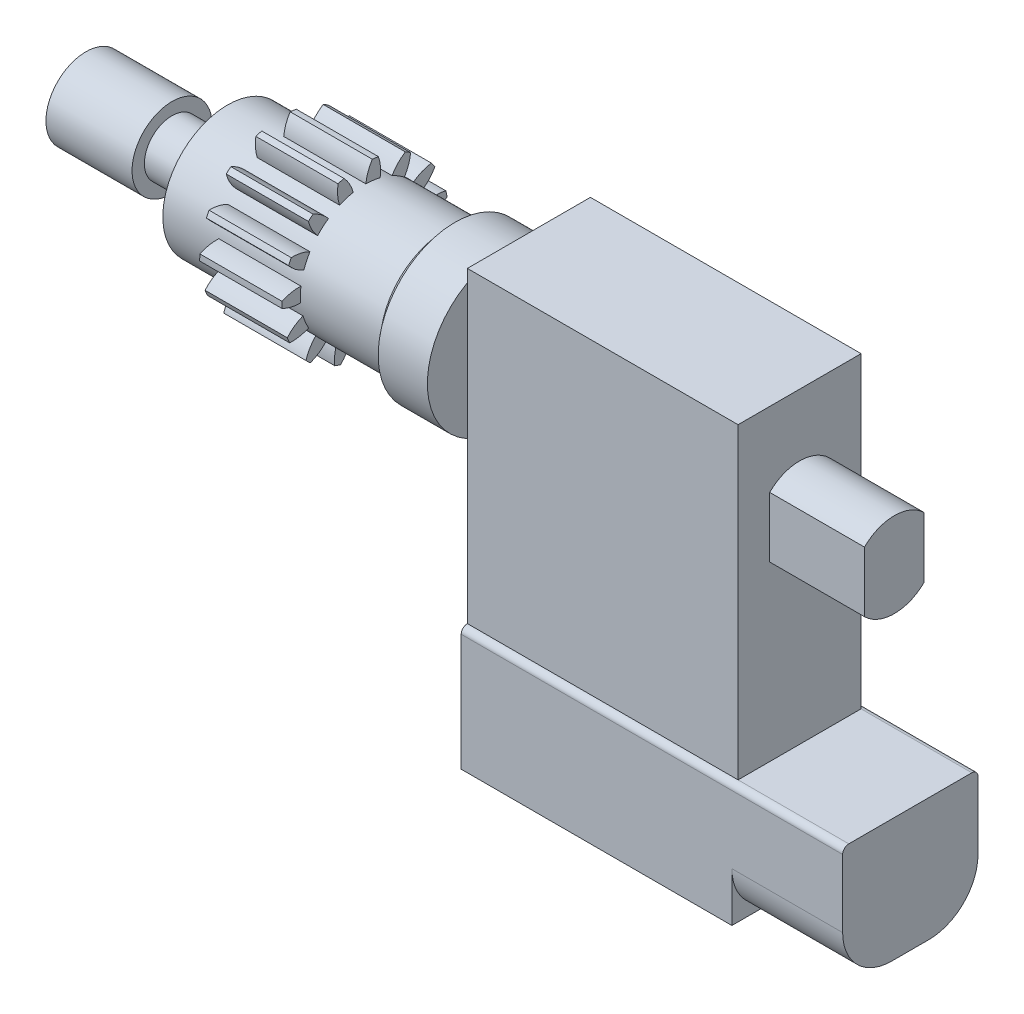
from build123d import *
from build123d.topology import SkipClean

# Parameters (mm, degrees)
ESQUISSE1_W             = 22
ESQUISSE1_H             = 25
EXTRUSION1_DEPTH        = 5
EXTRUSION2_DEPTH        = 22
EXTRUSION3_DEPTH        = 9
EXTRUSION4_DEPTH        = 7.7
ESQUISSE6_R             = 1.25
EXTRUSION5_DEPTH        = 36
ENL_V_MAT_EXTRU_2_DEPTH = 6.678544503


with BuildPart() as part:
    # Esquisse1 → Extrusion1 (new, symmetric)
    with BuildSketch(Plane.XY):
        with Locations((11, 12.5)):
            Rectangle(ESQUISSE1_W, ESQUISSE1_H)
    extrude(amount=EXTRUSION1_DEPTH, both=True)

    # Esquisse2 → Extrusion2 (add)
    with BuildSketch(Plane.ZY):
        with BuildLine():
            Line((-5, 0), (5, 0))
            ThreePointArc((5, 0), (5.353553391, -0.146446609), (5.5, -0.5))
            Line((5.5, -0.5), (5.5, -10))
            Line((5.5, -10), (-5.5, -10))
            Line((-5.5, -10), (-5.5, -0.5))
            ThreePointArc((-5.5, -0.5), (-5.353553391, -0.146446609), (-5, 0))
        make_face()
    extrude(amount=-EXTRUSION2_DEPTH)

    # Esquisse4 → Extrusion3 (add)
    with BuildSketch(Plane(origin=(22, 0, 0), x_dir=(0, 0, -1), z_dir=(1, 0, 0))):
        with BuildLine():
            Line((5.5, -6), (5.5, -0.5))
            ThreePointArc((5.5, -0.5), (5.353553391, -0.146446609), (5, 0))
            Line((5, 0), (-5, 0))
            ThreePointArc((-5, 0), (-5.353553391, -0.146446609), (-5.5, -0.5))
            Line((-5.5, -0.5), (-5.5, -6))
            ThreePointArc((-5.5, -6), (-4.328427125, -8.828427125), (-1.5, -10))
            Line((-1.5, -10), (1.5, -10))
            ThreePointArc((1.5, -10), (4.328427125, -8.828427125), (5.5, -6))
        make_face()
    extrude(amount=EXTRUSION3_DEPTH)

    # Esquisse5 → Extrusion4 (add)
    with BuildSketch(Plane(origin=(22, 0, 0), x_dir=(0, 0, -1), z_dir=(1, 0, 0))):
        with BuildLine():
            Line((-2.42899156, 18.95), (-2.42899156, 14.05))
            ThreePointArc((-2.42899156, 14.05), (0, 13.05), (2.42899156, 14.05))
            Line((2.42899156, 14.05), (2.42899156, 18.95))
            ThreePointArc((2.42899156, 18.95), (0, 19.95), (-2.42899156, 18.95))
        make_face()
    extrude(amount=EXTRUSION4_DEPTH)

    # Esquisse6 → Extrusion5 (add)
    with BuildSketch(Plane.ZY):
        with Locations(Location((0, 16.5, 0), (0, 0, 180))):
            Circle(ESQUISSE6_R)
    extrude(amount=EXTRUSION5_DEPTH)

    # Esquisse7 → Révolution1 (revolve)
    with BuildSketch(Plane.XY, mode=Mode.PRIVATE) as r_volution1_sk:
        Polygon((-2, 17.75), (-2, 22.75), (-6, 22.75), (-6.821455497, 21.75), (-13.321455497, 21.75), (-13.321455497, 23.25), (-20, 23.25), (-20, 21.75), (-24.5, 21.75), (-24.5, 18.75), (-29, 18.75), (-29, 19.75), (-36, 19.75), (-36, 17.75), align=None)
    revolve(r_volution1_sk.sketch.rotate(Axis((0, 16.5, 0), (-1, 0, 0)), 90), axis=Axis((0, 16.5, 0), (-1, 0, 0)))

    # Esquisse8 → Enlèv. mat.-Extru.2 (cut)
    with SkipClean():  # the faces are left unmerged after this step: merging them gives an invalid solid
        with BuildSketch(Plane.ZY.offset(20)):
            with BuildLine():
                ThreePointArc((-3.202562433, 20.660059358), (-3.544451524, 21.369801094), (-3.707751714, 22.140485549))
                ThreePointArc((-3.707751714, 22.140485549), (-4.620864959, 21.420376716), (-5.396827126, 20.554227049))
                ThreePointArc((-5.396827126, 20.554227049), (-4.63790237, 20.342910474), (-3.951001573, 19.957178991))
                ThreePointArc((-3.951001573, 19.957178991), (-3.594006079, 20.326959668), (-3.202562433, 20.660059358))
            make_face()
            with BuildLine():
                ThreePointArc((-1.233637785, 21.603002823), (-1.25729104, 22.390442983), (-1.093007579, 23.160918438))
                ThreePointArc((-1.093007579, 23.160918438), (-2.220072686, 22.874462901), (-3.281244207, 22.398808054))
                ThreePointArc((-3.281244207, 22.398808054), (-2.673882137, 21.897078248), (-2.203258163, 21.26530728))
                ThreePointArc((-2.203258163, 21.26530728), (-1.7267232, 21.457915589), (-1.233637785, 21.603002823))
            make_face()
            with BuildLine():
                ThreePointArc((0.948594043, 21.663590741), (1.247266486, 22.392573768), (1.710727497, 23.029618016))
                ThreePointArc((1.710727497, 23.029618016), (0.564590324, 23.226346539), (-0.598304355, 23.223431557))
                ThreePointArc((-0.598304355, 23.223431557), (-0.247523392, 22.518042162), (-0.0745514, 21.749470648))
                ThreePointArc((-0.0745514, 21.749470648), (0.439125807, 21.731602864), (0.948594043, 21.663590741))
            make_face()
            with BuildLine():
                ThreePointArc((4.218662246, 21.769287319), (3.251630537, 22.415183754), (2.188087756, 22.885512663))
                ThreePointArc((2.188087756, 22.885512663), (2.221634397, 22.098431915), (2.067045976, 21.325952852))
                ThreePointArc((2.067045976, 21.325952852), (2.529045974, 21.100698476), (2.966805343, 20.83134691))
                ThreePointArc((2.966805343, 20.83134691), (3.536160307, 21.375825016), (4.218662246, 21.769287319))
            make_face()
            with BuildLine():
                ThreePointArc((5.997151968, 19.597848975), (5.376434291, 20.581231961), (4.596139615, 21.44348062))
                ThreePointArc((4.596139615, 21.44348062), (4.306651415, 20.710801929), (3.851232325, 20.067983966))
                ThreePointArc((3.851232325, 20.067983966), (4.181671115, 19.674291525), (4.472029047, 19.250173849))
                ThreePointArc((4.472029047, 19.250173849), (5.213619885, 19.516001823), (5.997151968, 19.597848975))
            make_face()
            with BuildLine():
                ThreePointArc((6.738679632, 16.8907644), (6.571603712, 18.041598084), (6.209477181, 19.146675867))
                ThreePointArc((6.209477181, 19.146675867), (5.647009279, 18.595086036), (4.969505618, 18.193078237))
                ThreePointArc((4.969505618, 18.193078237), (5.111247332, 17.699020732), (5.203998302, 17.193470745))
                ThreePointArc((5.203998302, 17.193470745), (5.98959722, 17.134684515), (6.738679632, 16.8907644))
            make_face()
            with BuildLine():
                ThreePointArc((6.315028369, 14.116113111), (6.63048315, 15.235407894), (6.74913973, 16.392236812))
                ThreePointArc((6.74913973, 16.392236812), (6.010947937, 16.117110733), (5.228506242, 16.0254239))
                ThreePointArc((5.228506242, 16.0254239), (5.15704245, 15.516428362), (5.036148973, 15.016860249))
                ThreePointArc((5.036148973, 15.016860249), (5.729918783, 14.643624489), (6.315028369, 14.116113111))
            make_face()
            with BuildLine():
                ThreePointArc((4.79945133, 11.753657521), (5.542891816, 12.647877167), (6.121814706, 13.656430992))
                ThreePointArc((6.121814706, 13.656430992), (5.335539089, 13.705340464), (4.583450638, 13.939828082))
                ThreePointArc((4.583450638, 13.939828082), (4.311138079, 13.503904463), (3.997503735, 13.09669809))
                ThreePointArc((3.997503735, 13.09669809), (4.479485333, 12.473548654), (4.79945133, 11.753657521))
            make_face()
            with BuildLine():
                ThreePointArc((2.454005555, 10.211887665), (3.496884131, 10.726413474), (4.435972305, 11.412304086))
                ThreePointArc((4.435972305, 11.412304086), (3.737567061, 11.776792217), (3.145874779, 12.296909248))
                ThreePointArc((3.145874779, 12.296909248), (2.719798768, 12.009432702), (2.267653785, 11.76499775))
                ThreePointArc((2.267653785, 11.76499775), (2.454508175, 10.999682835), (2.454005555, 10.211887665))
            make_face()
            with BuildLine():
                ThreePointArc((-4.617734942, 18.997803837), (-5.218744139, 19.507126354), (-5.681391894, 20.144761467))
                ThreePointArc((-5.681391894, 20.144761467), (-6.222667702, 19.115512697), (-6.579249607, 18.008633356))
                ThreePointArc((-6.579249607, 18.008633356), (-5.799987148, 18.124268567), (-5.015580917, 18.051273047))
                ThreePointArc((-5.015580917, 18.051273047), (-4.839852657, 18.534287653), (-4.617734942, 18.997803837))
            make_face()
            with BuildLine():
                ThreePointArc((-5.234459128, 16.90365534), (-5.990668481, 17.124492149), (-6.672667801, 17.518825015))
                ThreePointArc((-6.672667801, 17.518825015), (-6.748514668, 16.358402772), (-6.624060061, 15.202183251))
                ThreePointArc((-6.624060061, 15.202183251), (-5.959201458, 15.624775868), (-5.212920756, 15.8771379))
                ThreePointArc((-5.212920756, 15.8771379), (-5.248844742, 16.389868823), (-5.234459128, 16.90365534))
            make_face()
            with BuildLine():
                ThreePointArc((-4.946097778, 14.739711168), (-5.72675182, 14.633877579), (-6.510178827, 14.716724463))
                ThreePointArc((-6.510178827, 14.716724463), (-6.10748214, 13.625776294), (-5.523510351, 12.620137451))
                ThreePointArc((-5.523510351, 12.620137451), (-5.088015698, 13.276617374), (-4.508899238, 13.810701269))
                ThreePointArc((-4.508899238, 13.810701269), (-4.750263886, 14.264492673), (-4.946097778, 14.739711168))
            make_face()
            with BuildLine():
                ThreePointArc((-2.001435869, 11.646469897), (-2.445145697, 10.995514391), (-3.030927918, 10.46875005))
                ThreePointArc((-3.030927918, 10.46875005), (-1.950738753, 10.0380252), (-0.812650054, 9.799097084))
                ThreePointArc((-0.812650054, 9.799097084), (-1.00910691, 10.562003491), (-1.018504045, 11.349742772))
                ThreePointArc((-1.018504045, 11.349742772), (-1.517241252, 11.4740196), (-2.001435869, 11.646469897))
            make_face()
            with BuildLine():
                ThreePointArc((-0.315760074, 9.757389558), (0.846233411, 9.803255342), (1.983109992, 10.047886024))
                ThreePointArc((1.983109992, 10.047886024), (1.493335733, 10.664929505), (1.164348592, 11.380742988))
                ThreePointArc((1.164348592, 11.380742988), (0.658181542, 11.291420822), (0.145705895, 11.252022314))
                ThreePointArc((0.145705895, 11.252022314), (0.005124254, 10.476871823), (-0.315760074, 9.757389558))
            make_face()
            with BuildLine():
                ThreePointArc((-3.802511188, 12.880136927), (-4.472627743, 12.465932528), (-5.22202079, 12.222968452))
                ThreePointArc((-5.22202079, 12.222968452), (-4.410410464, 11.390129206), (-3.467895523, 10.708955134))
                ThreePointArc((-3.467895523, 10.708955134), (-3.3370658, 11.485811019), (-3.02524808, 12.20926882))
                ThreePointArc((-3.02524808, 12.20926882), (-3.43031925, 12.525656049), (-3.802511188, 12.880136927))
            make_face()
        extrude(amount=-ENL_V_MAT_EXTRU_2_DEPTH, mode=Mode.SUBTRACT)


solid = part.part
